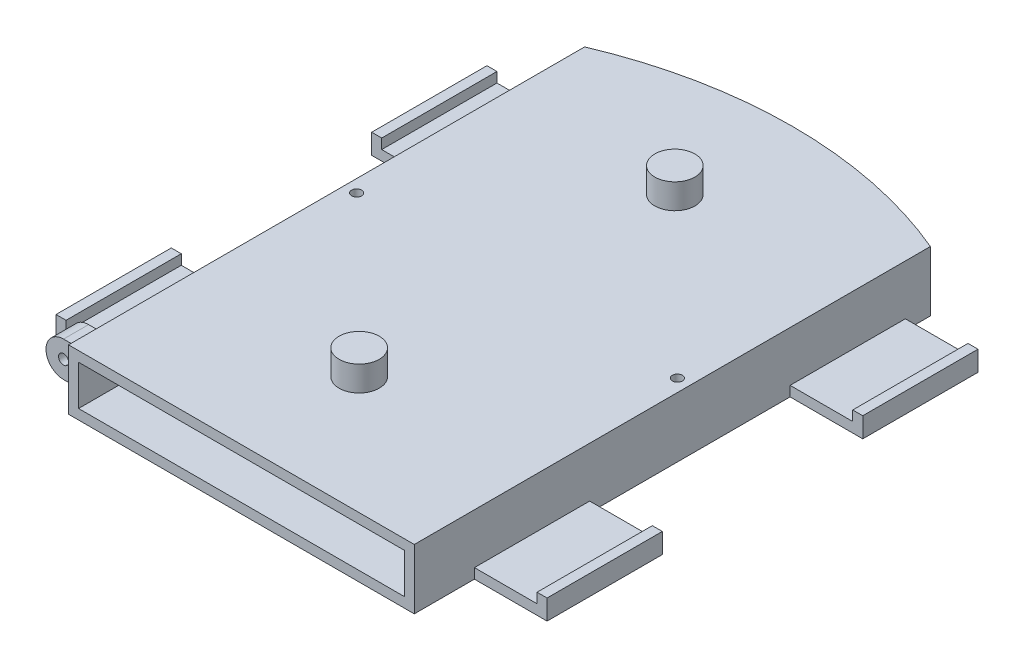
from build123d import *

# Parameters (mm, degrees)
CROQUIS1_W                 = 69
CROQUIS1_H                 = 103
CROQUIS1_W_2               = 65
CROQUIS1_H_2               = 99
CROQUIS1_W_3               = 63
CROQUIS1_H_3               = 97
CROQUIS1_H_4               = 2
CROQUIS1_H_5               = 7
SALIENTE_EXTRUIR1_DEPTH    = 2
SALIENTE_EXTRUIR2_DEPTH    = 8
SALIENTE_EXTRUIR3_START    = -10
CROQUIS3_W                 = 69
CROQUIS3_H                 = 110
SALIENTE_EXTRUIR3_DEPTH    = 2
CROQUIS5_W                 = 12.5
CROQUIS5_H                 = 23
SALIENTE_EXTRUIR4_DEPTH    = 2
CROQUIS5_3_W               = 2
CROQUIS5_3_H               = 23
SALIENTE_EXTRUIR5_DEPTH    = 4
CORTAR_EXTRUIR1_DEPTH      = 78.24797732
CORTAR_EXTRUIR1_DEPTH_BACK = 2
CROQUIS6_R                 = 1
CROQUIS7_R                 = 4
SALIENTE_EXTRUIR6_DEPTH    = 5
CORTAR_EXTRUIR2_DEPTH      = 78.770495691
CORTAR_EXTRUIR2_DEPTH_BACK = 78.770495691
SALIENTE_EXTRUIR7_REACH    = 79.77
SALIENTE_EXTRUIR8_START    = -3
SALIENTE_EXTRUIR8_DEPTH    = 5
CORTAR_EXTRUIR3_START      = -3
CROQUIS10_3_R              = 1
CORTAR_EXTRUIR3_DEPTH      = 4


with BuildPart() as part:
    # Croquis1 → Saliente-Extruir1 (new body)
    # profile 1 of 6: a face of its own
    with BuildSketch(Plane(origin=(0, 0, 0), x_dir=(1, 0, 0), z_dir=(0, 1, 0))):
        Rectangle(CROQUIS1_W, CROQUIS1_H)
        Rectangle(CROQUIS1_W_2, CROQUIS1_H_2, mode=Mode.SUBTRACT)
    # profile 2 of 6: a face of its own
    with BuildSketch(Plane(origin=(0, 0, 0), x_dir=(1, 0, 0), z_dir=(0, 1, 0))):
        Rectangle(CROQUIS1_W_2, CROQUIS1_H_2)
        Rectangle(CROQUIS1_W_3, CROQUIS1_H_3, mode=Mode.SUBTRACT)
    # profile 3 of 6: a face of its own
    with BuildSketch(Plane(origin=(0, 0, 0), x_dir=(1, 0, 0), z_dir=(0, 1, 0))):
        Polygon((-31.5, 48.5), (31.5, 48.5), (31.5, -48.5), align=None)
    # profile 4 of 6: a face of its own
    with BuildSketch(Plane(origin=(0, 0, 0), x_dir=(1, 0, 0), z_dir=(0, 1, 0))):
        Polygon((-31.5, 48.5), (31.5, -48.5), (-31.5, -48.5), align=None)
    # profile 5 of 6: a face of its own
    with BuildSketch(Plane(origin=(0, 0, 0), x_dir=(1, 0, 0), z_dir=(0, 1, 0))):
        with Locations((0, -50.5)):
            Rectangle(CROQUIS1_W_2, CROQUIS1_H_4)
    # profile 6 of 6: a face of its own
    with BuildSketch(Plane(origin=(0, 0, 0), x_dir=(1, 0, 0), z_dir=(0, 1, 0))):
        with Locations((0, 55)):
            Rectangle(CROQUIS1_W, CROQUIS1_H_5)
    extrude(amount=-SALIENTE_EXTRUIR1_DEPTH)

    # Croquis1<3> → Saliente-Extruir2 (add)
    with BuildSketch(Plane(origin=(0, 0, 0), x_dir=(1, 0, 0), z_dir=(0, 1, 0))):
        Polygon((-32.5, -49.5), (-32.5, 49.5), (32.5, 49.5), (32.5, -49.5), (32.5, -51.5), (34.5, -51.5), (34.5, 51.5), (-34.5, 51.5), (-34.5, -51.5), (-32.5, -51.5), align=None)
    extrude(amount=SALIENTE_EXTRUIR2_DEPTH)

    # Croquis3 → Saliente-Extruir3 (add)
    with BuildSketch(Plane.XZ.offset(2).offset(SALIENTE_EXTRUIR3_START)):
        with Locations((0, -3.5)):
            Rectangle(CROQUIS3_W, CROQUIS3_H)
    extrude(amount=-SALIENTE_EXTRUIR3_DEPTH)

    # Croquis5 → Saliente-Extruir4 (add)
    with BuildSketch(Plane.XZ.offset(2)):
        with Locations((-40.75, 28)):
            Rectangle(CROQUIS5_W, CROQUIS5_H)
        with Locations((40.75, 28)):
            Rectangle(CROQUIS5_W, CROQUIS5_H)
        with Locations((40.75, -35)):
            Rectangle(CROQUIS5_W, CROQUIS5_H)
        with Locations((-40.75, -35)):
            Rectangle(CROQUIS5_W, CROQUIS5_H)
    extrude(amount=-SALIENTE_EXTRUIR4_DEPTH)

    # Croquis5<3> → Saliente-Extruir5 (add)
    with BuildSketch(Plane.XZ.offset(2)):
        with Locations((48, 28)):
            Rectangle(CROQUIS5_3_W, CROQUIS5_3_H)
        with Locations((48, -35)):
            Rectangle(CROQUIS5_3_W, CROQUIS5_3_H)
        with Locations((-48, -35)):
            Rectangle(CROQUIS5_3_W, CROQUIS5_3_H)
        with Locations((-48, 28)):
            Rectangle(CROQUIS5_3_W, CROQUIS5_3_H)
    extrude(amount=-SALIENTE_EXTRUIR5_DEPTH)

    # Croquis6 → Cortar-Extruir1 (cut, two sides: drawn at the far end of the back side and taken through both)
    with BuildSketch(Plane(origin=(0, 10, 0), x_dir=(1, 0, 0), z_dir=(0, 1, 0)).offset(-CORTAR_EXTRUIR1_DEPTH_BACK)):
        with Locations(Location((32, 3.5, 0), (0, 0, 270))):
            Circle(CROQUIS6_R)
        with Locations(Location((-32, 3.5, 0), (0, 0, 270))):
            Circle(CROQUIS6_R)
    extrude(amount=CORTAR_EXTRUIR1_DEPTH + CORTAR_EXTRUIR1_DEPTH_BACK, mode=Mode.SUBTRACT)

    # Croquis7 → Saliente-Extruir6 (add)
    with BuildSketch(Plane(origin=(0, 10, 0), x_dir=(1, 0, 0), z_dir=(0, 1, 0))):
        with Locations(Location((0, 35, 0), (0, 0, 270))):
            Circle(CROQUIS7_R)
        with Locations(Location((0, -28, 0), (0, 0, 270))):
            Circle(CROQUIS7_R)
    extrude(amount=SALIENTE_EXTRUIR6_DEPTH)

    # Croquis8 → Cortar-Extruir2 (cut, two sides: drawn at the far end of the back side and taken through both)
    with BuildSketch(Plane(origin=(0, 0, 0), x_dir=(1, 0, 0), z_dir=(0, 1, 0)).offset(-CORTAR_EXTRUIR2_DEPTH_BACK)):
        with BuildLine():
            Line((-34.5, 58.5), (-34.5, 51.5))
            ThreePointArc((-34.5, 51.5), (-17.601491564, 56.73235051), (-3.06e-07, 58.5))
            Line((-3.06e-07, 58.5), (-34.5, 58.5))
        make_face()
        with BuildLine():
            Line((34.5, 58.5), (-3.06e-07, 58.5))
            ThreePointArc((-3.06e-07, 58.5), (17.601491264, 56.732350571), (34.5, 51.5))
            Line((34.5, 51.5), (34.5, 58.5))
        make_face()
    extrude(amount=CORTAR_EXTRUIR2_DEPTH + CORTAR_EXTRUIR2_DEPTH_BACK, mode=Mode.SUBTRACT)

    # Croquis9 → Saliente-Extruir7 (add, up to next)
    with BuildSketch(Plane(origin=(0, 0, 0), x_dir=(1, 0, 0), z_dir=(0, 1, 0)), mode=Mode.PRIVATE) as saliente_extruir7_sk1:
        with BuildLine():
            Line((-34.5, 51.5), (34.5, 51.5))
            ThreePointArc((34.5, 51.5), (0, 58.5), (-34.5, 51.5))
        make_face()
    saliente_extruir7_tool1 = extrude(saliente_extruir7_sk1.sketch, amount=SALIENTE_EXTRUIR7_REACH, mode=Mode.PRIVATE) - part.part
    add(saliente_extruir7_tool1.solids().sort_by_distance((0, 0, -54.309712))[0])

    # Croquis10 → Saliente-Extruir8 (add)
    with BuildSketch(Plane.XY.offset(51.5).offset(SALIENTE_EXTRUIR8_START)):
        with BuildLine():
            Line((-38.5, 0.5), (-34.5, 0.5))
            Line((-34.5, 0.5), (-34.5, 7.5))
            Line((-34.5, 7.5), (-38.5, 7.5))
            ThreePointArc((-38.5, 7.5), (-42, 4), (-38.5, 0.5))
        make_face()
    extrude(amount=-SALIENTE_EXTRUIR8_DEPTH)

    # Croquis10<3> → Cortar-Extruir3 (cut)
    with BuildSketch(Plane.XY.offset(51.5).offset(CORTAR_EXTRUIR3_START)):
        with Locations((-38.5, 4)):
            Circle(CROQUIS10_3_R)
    extrude(amount=-CORTAR_EXTRUIR3_DEPTH, mode=Mode.SUBTRACT)


solid = part.part
